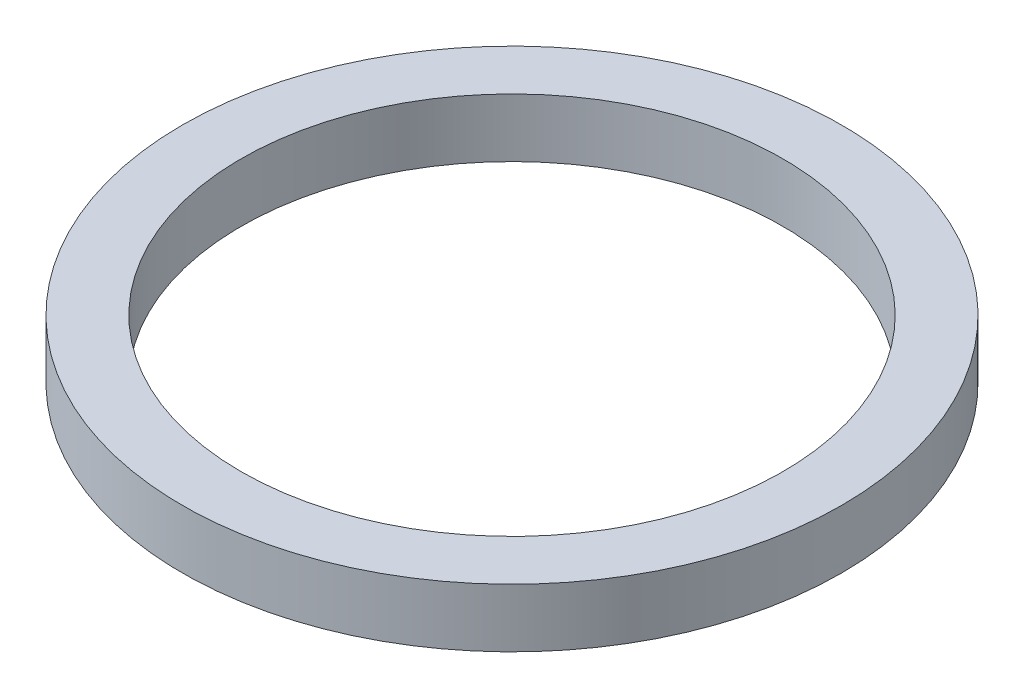
from build123d import *

# Parameters (mm, degrees)
SKETCH_1_R      = 285.75
SKETCH_1_R_2    = 234.95
EXTRUDE_1_DEPTH = 50.8


with BuildPart() as part:
    # 草圖1 → 伸長-薄件1 (new body)
    with BuildSketch(Plane(origin=(0, 0, 0), x_dir=(1, 0, 0), z_dir=(0, 1, 0))):
        Circle(SKETCH_1_R)
        Circle(SKETCH_1_R_2, mode=Mode.SUBTRACT)
    extrude(amount=EXTRUDE_1_DEPTH)


solid = part.part
